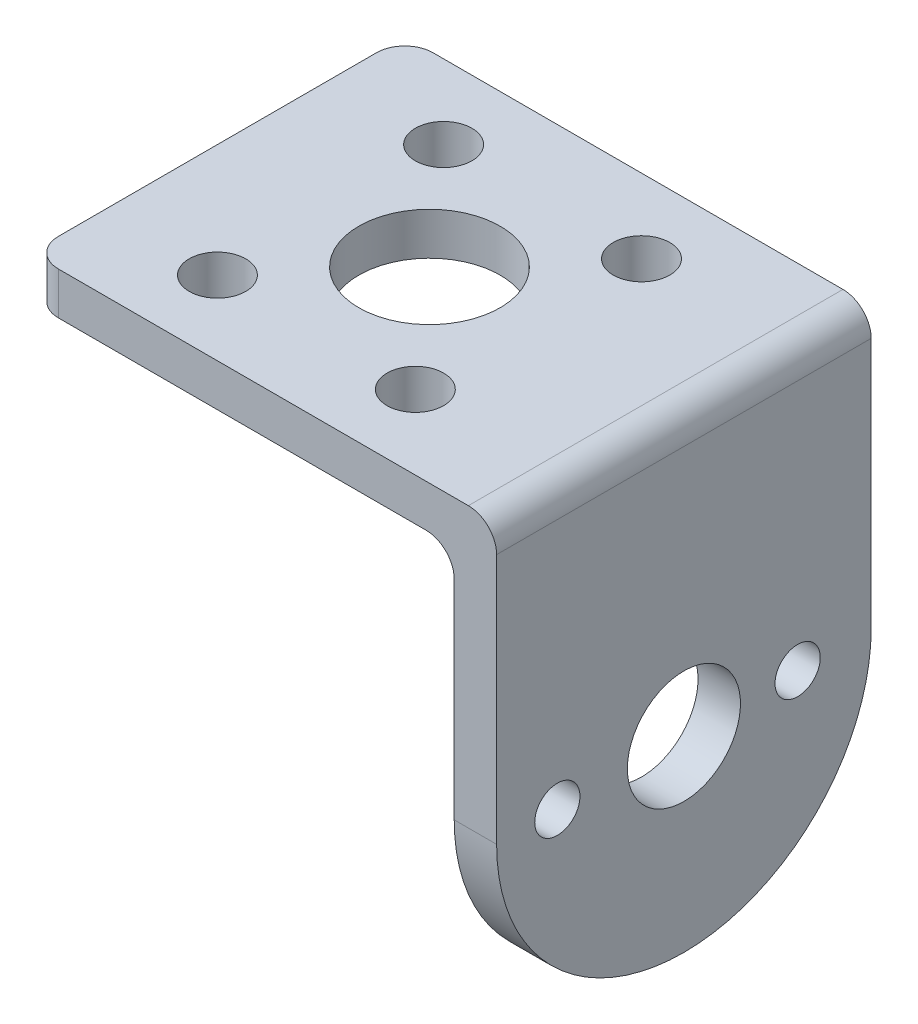
from build123d import *

# Parameters (mm, degrees)
SKETCH_1_W          = 30
SKETCH_1_H          = 26.5
EXTRUDE_1_DEPTH     = 3
SKETCH_2_R          = 5
CUT_EXTRUDE_1_DEPTH = 30.15187029
SKETCH_3_R          = 2
CUT_EXTRUDE_2_DEPTH = 30.15187029
EXTRUDE_3_DEPTH     = 3
SKETCH_7_R          = 4
SKETCH_7_R_2        = 1.6
CUT_EXTRUDE_3_DEPTH = 3
FILLET_1_R          = 2
FILLET_2_R          = 2


with BuildPart() as part:
    # 草图1 → 凸台-拉伸1 (new body)
    with BuildSketch(Plane(origin=(0, 0, 0), x_dir=(1, 0, 0), z_dir=(0, 1, 0))):
        with Locations((-10.540723982, -0.479638009)):
            Rectangle(SKETCH_1_W, SKETCH_1_H)
    extrude(amount=EXTRUDE_1_DEPTH)

    # 草图2 → 切除-拉伸1 (cut, through all)
    with BuildSketch(Plane(origin=(0, 3, 0), x_dir=(1, 0, 0), z_dir=(0, 1, 0))):
        with Locations(Location((-10.540723982, -0.479638009, 0), (0, 0, 270))):
            Circle(SKETCH_2_R)
    extrude(amount=-CUT_EXTRUDE_1_DEPTH, mode=Mode.SUBTRACT)

    # 草图3 → 切除-拉伸2 (cut, through all)
    with BuildSketch(Plane(origin=(0, 3, 0), x_dir=(1, 0, 0), z_dir=(0, 1, 0))):
        with Locations(Location((-3.540723982, 7.520361991, 0), (0, 0, 270))):
            Circle(SKETCH_3_R)
        with Locations(Location((-17.540723982, 7.520361991, 0), (0, 0, 270))):
            Circle(SKETCH_3_R)
        with Locations(Location((-3.540723982, -8.479638009, 0), (0, 0, 270))):
            Circle(SKETCH_3_R)
        with Locations(Location((-17.540723982, -8.479638009, 0), (0, 0, 270))):
            Circle(SKETCH_3_R)
    extrude(amount=-CUT_EXTRUDE_2_DEPTH, mode=Mode.SUBTRACT)

    # 草图6 → 凸台-拉伸3 (add)
    with BuildSketch(Plane(origin=(4.459276018, 0, 0), x_dir=(0, 0, -1), z_dir=(1, 0, 0))):
        with BuildLine():
            Line((12.770361991, 3), (-13.729638009, 3))
            Line((-13.729638009, 3), (-13.729638009, -16.75))
            ThreePointArc((-13.729638009, -16.75), (-0.479638009, -30), (12.770361991, -16.75))
            Line((12.770361991, -16.75), (12.770361991, 3))
        make_face()
    extrude(amount=EXTRUDE_3_DEPTH)

    # 草图7 → 切除-拉伸3 (cut)
    with BuildSketch(Plane.ZY.offset(-4.459276018)):
        with Locations((0.479638009, -16.75)):
            Circle(SKETCH_7_R)
        with Locations((9.432771386, -16.75)):
            Circle(SKETCH_7_R_2)
        with Locations((-7.567228614, -16.75)):
            Circle(SKETCH_7_R_2)
    extrude(amount=-CUT_EXTRUDE_3_DEPTH, mode=Mode.SUBTRACT)

    # 圆角1
    fillet_1_edges = [part.edges().sort_by_distance(p)[0] for p in [
        (-25.540723982, 1.5, -12.770361991),
        (-25.540723982, 1.5, 13.729638009),
    ]]
    fillet(fillet_1_edges, radius=FILLET_1_R)

    # 圆角2
    fillet_2_edges = [part.edges().sort_by_distance(p)[0] for p in [
        (7.459276018, 3, 0.479638009),
        (4.459276018, 0, 0.479638009),
    ]]
    fillet(fillet_2_edges, radius=FILLET_2_R)


solid = part.part
